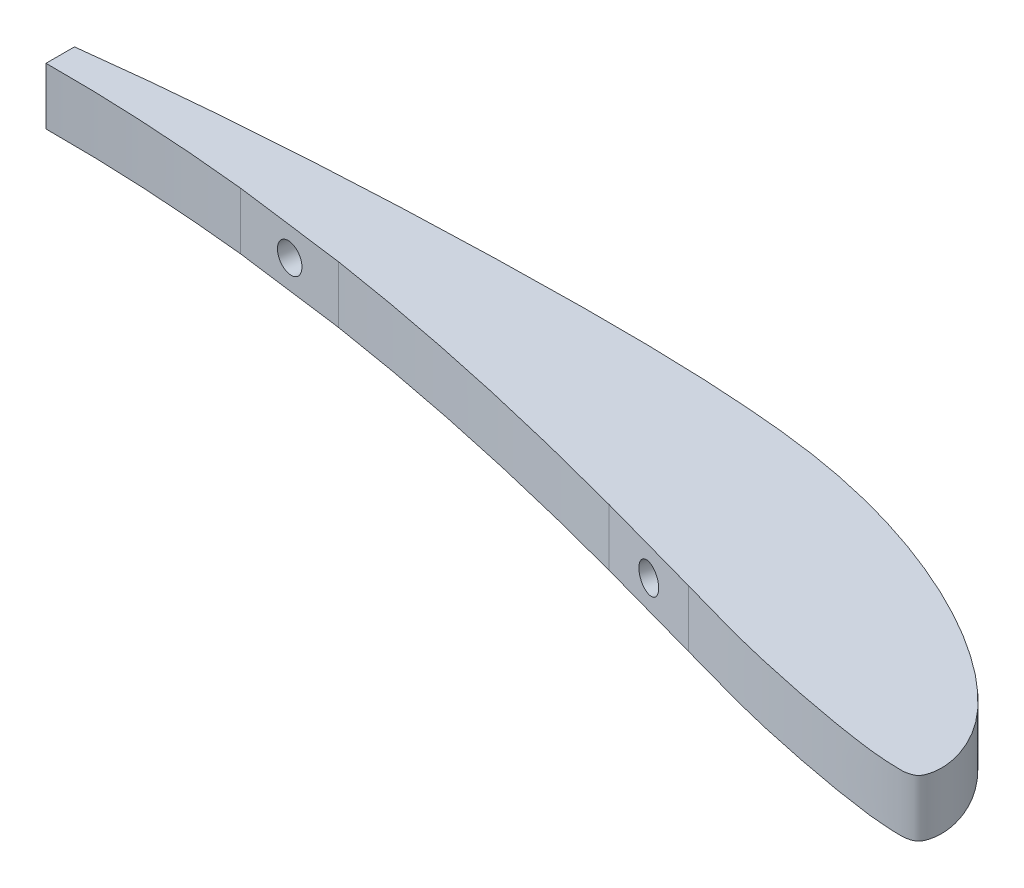
from build123d import *

# Parameters (mm, degrees)
BOSS_EXTRUDE1_DEPTH                       = 6.35
F_1_4_0_25_DIAMETER_HOLE1_D               = 6.35
F_1_4_0_25_DIAMETER_HOLE1_DEPTH           = 12.7
F_1_4_0_25_DIAMETER_HOLE1_TIP             = 1.907732465
F_1_4_0_25_DIAMETER_HOLE1_ON_FACE_2_D     = 6.35
F_1_4_0_25_DIAMETER_HOLE1_ON_FACE_2_DEPTH = 12.7
F_1_4_0_25_DIAMETER_HOLE1_ON_FACE_2_TIP   = 1.907732465


with BuildPart() as part:
    # Sketch1 → Boss-Extrude1 (new, symmetric)
    with BuildSketch(Plane(origin=(0, 0, 0), x_dir=(1, 0, 0), z_dir=(0, 1, 0))):
        with BuildLine():
            Line((-597.776391121, -916.802501561), (-573.303690133, -923.60300936))
            add(Edge.make_bspline(
                [(-573.303690133, -923.60300936), (-572.302950396, -923.885809681), (-568.099460895, -925.074217335), (-560.98426201, -927.085132383), (-552.153134358, -929.351793486), (-544.047010511, -931.12933223), (-536.68633558, -932.606040356), (-530.108904544, -933.796548077), (-524.381359639, -934.681063633), (-519.572677977, -935.309823737), (-515.722704659, -935.509297913), (-512.904850763, -935.614509438), (-510.731548466, -934.803578714), (-509.995877918, -932.852574873), (-509.710588794, -930.680317226), (-509.97948314, -928.059090991), (-510.771882292, -925.175527306), (-512.13170887, -922.092676733), (-514.056157039, -918.877948489), (-516.642060662, -915.616901186), (-519.878140771, -912.336806982), (-523.710878001, -909.009603172), (-528.144071182, -905.698403477), (-533.151760779, -902.445104766), (-538.70814838, -899.283988977), (-544.799372855, -896.27061322), (-551.387398729, -893.421592702), (-558.447971928, -890.792240249), (-565.95356642, -888.420626997), (-573.904555797, -886.401963545), (-582.302577432, -884.732531083), (-591.189649692, -883.495409148), (-600.566009592, -882.653332524), (-610.398787901, -882.031392965), (-620.641966713, -881.682741386), (-631.23344004, -881.550564489), (-642.109440981, -881.598155151), (-653.189236879, -881.776525137), (-664.381516728, -882.072222381), (-675.59176147, -882.461412521), (-686.732134705, -882.961422295), (-697.722460945, -883.57453185), (-708.492099406, -884.294448937), (-718.972610172, -885.130375886), (-729.102517036, -886.065145309), (-738.061681725, -887.020885679), (-743.634498035, -887.686438438), (-745.964774994, -887.978945771)],
                knots=[0.381900739, 0.381900739, 0.381900739, 0.381900739, 0.386864963, 0.402753039, 0.417195876, 0.430379519, 0.442362633, 0.453032156, 0.462284346, 0.470026206, 0.476176645, 0.480649947, 0.483553073, 0.486420689, 0.489953231, 0.494096927, 0.498850588, 0.50419675, 0.510125492, 0.516691031, 0.524011699, 0.532092122, 0.540897921, 0.550403414, 0.560581041, 0.571396483, 0.582828081, 0.594829641, 0.607347037, 0.620384325, 0.633968937, 0.648199967, 0.663193937, 0.678898581, 0.695226562, 0.712113221, 0.729459406, 0.747143117, 0.765009772, 0.782904928, 0.800688045, 0.818242105, 0.835449083, 0.852211621, 0.868429578, 0.884009363, 0.895220401, 0.895220401, 0.895220401, 0.895220401], degree=3))
            Line((-745.964774994, -887.978945771), (-745.964774994, -894.328945771))
            add(Edge.make_bspline(
                [(-745.964774994, -894.328945771), (-744.1339042, -894.315721527), (-737.978827427, -894.322601244), (-727.312590058, -894.617094054), (-713.845005558, -895.431888243), (-704.715487743, -896.266834181), (-700.088539907, -896.757033354)],
                knots=[0.102282201, 0.102282201, 0.102282201, 0.102282201, 0.111021837, 0.131661709, 0.153207715, 0.175417809, 0.175417809, 0.175417809, 0.175417809], degree=3))
            Line((-700.088539907, -896.757033354), (-674.903690133, -900.056024387))
            add(Edge.make_bspline(
                [(-674.903690133, -900.056024387), (-673.832475339, -900.221916956), (-668.024145961, -901.138350817), (-657.550796792, -902.953772352), (-643.616607748, -905.709113801), (-630.00776799, -908.68984122), (-616.843534104, -911.833301283), (-606.152562091, -914.5660148), (-599.861126076, -916.241106363), (-597.776391121, -916.802501561)],
                knots=[0.21583707, 0.21583707, 0.21583707, 0.21583707, 0.221011446, 0.243905882, 0.266573311, 0.288810349, 0.310405036, 0.331177743, 0.341483927, 0.341483927, 0.341483927, 0.341483927], degree=3))
        make_face()
    extrude(amount=BOSS_EXTRUDE1_DEPTH, both=True)

    # 1/4 (0.25) Diameter Hole1
    with Locations(Plane(origin=(-585.540040627, 0, 920.202755461), x_dir=(0.963492164909, 0, 0.267736527501), z_dir=(-0.267736527501, 0, 0.963492164909))):
        with Locations((0, 0)):
            Hole(F_1_4_0_25_DIAMETER_HOLE1_D / 2, depth=F_1_4_0_25_DIAMETER_HOLE1_DEPTH)
            with Locations((0, 0, -(F_1_4_0_25_DIAMETER_HOLE1_DEPTH + F_1_4_0_25_DIAMETER_HOLE1_TIP / 2))):  # 118° drill point
                Cone(0, F_1_4_0_25_DIAMETER_HOLE1_D / 2, F_1_4_0_25_DIAMETER_HOLE1_TIP, mode=Mode.SUBTRACT)

    # 1/4 (0.25) Diameter Hole1 on face 2
    with Locations(Plane(origin=(-687.49611502, 0, 898.40652887), x_dir=(0.99152946714, 0, 0.1298819302), z_dir=(-0.1298819302, 0, 0.99152946714))):
        with Locations((0, 0)):
            Hole(F_1_4_0_25_DIAMETER_HOLE1_ON_FACE_2_D / 2, depth=F_1_4_0_25_DIAMETER_HOLE1_ON_FACE_2_DEPTH)
            with Locations((0, 0, -(F_1_4_0_25_DIAMETER_HOLE1_ON_FACE_2_DEPTH + F_1_4_0_25_DIAMETER_HOLE1_ON_FACE_2_TIP / 2))):  # 118° drill point
                Cone(0, F_1_4_0_25_DIAMETER_HOLE1_ON_FACE_2_D / 2, F_1_4_0_25_DIAMETER_HOLE1_ON_FACE_2_TIP, mode=Mode.SUBTRACT)


solid = part.part
